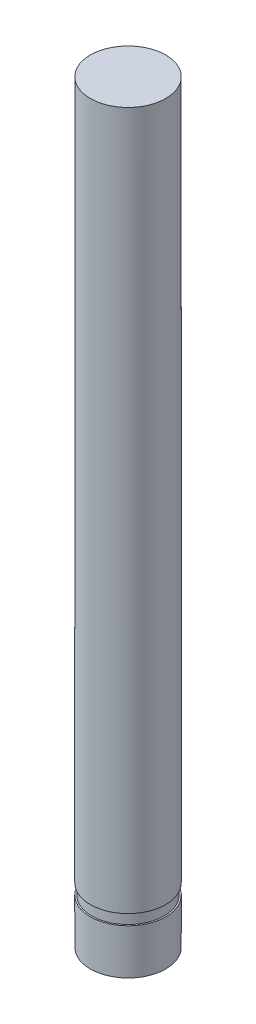
from build123d import *

# Parameters (mm, degrees)
SKETCH1_R           = 2.5
BOSS_EXTRUDE1_DEPTH = 50
SKETCH2_R           = 2.5
SKETCH2_R_2         = 2.4
CUT_EXTRUDE1_DEPTH  = 0.7


with BuildPart() as part:
    # Sketch1 → Boss-Extrude1 (new body)
    with BuildSketch(Plane(origin=(0, 0, 0), x_dir=(1, 0, 0), z_dir=(0, 1, 0))):
        with Locations(Location((0, 0, 0), (0, 0, 270))):
            Circle(SKETCH1_R)
    extrude(amount=BOSS_EXTRUDE1_DEPTH)

    # Sketch2 → Cut-Extrude1 (cut)
    with BuildSketch(Plane(origin=(0, 3.000000096, 0), x_dir=(-1, 0, 0), z_dir=(0, -1, 0))):
        with Locations(Location((0, 0, 0), (0, 0, 90))):
            Circle(SKETCH2_R)
        with Locations(Location((0, 0, 0), (0, 0, 90))):
            Circle(SKETCH2_R_2, mode=Mode.SUBTRACT)
    extrude(amount=-CUT_EXTRUDE1_DEPTH, mode=Mode.SUBTRACT)


solid = part.part
